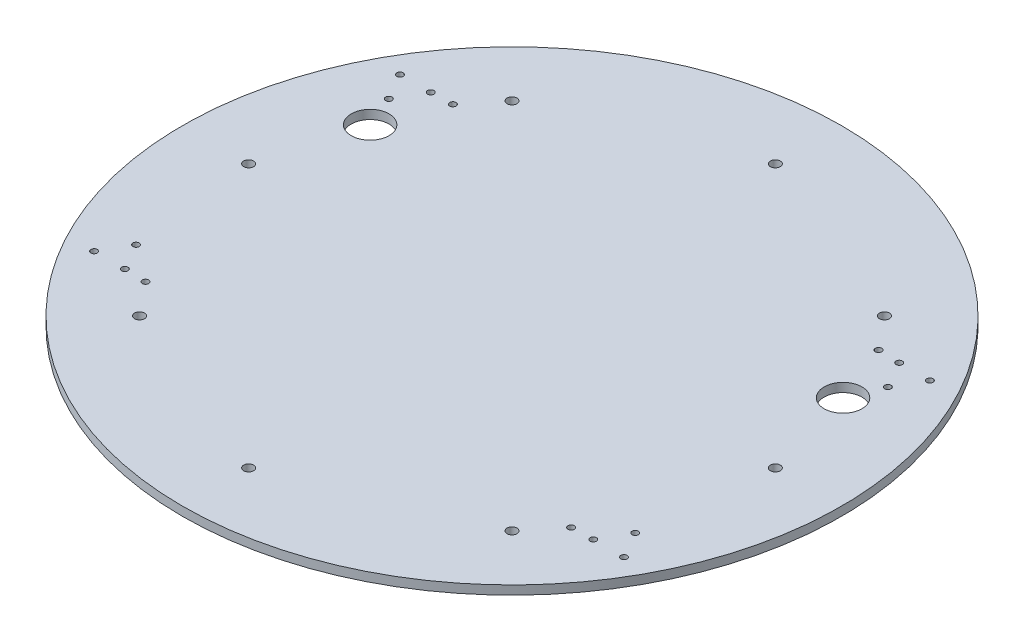
from build123d import *

# Parameters (mm, degrees)
SKETCH1_R           = 177
BOSS_EXTRUDE1_DEPTH = 4.7625
SKETCH3_R           = 1.7
CUT_EXTRUDE1_DEPTH  = 2.54
SKETCH4_R           = 1.7
CUT_EXTRUDE2_DEPTH  = 251.361102023
SKETCH5_R           = 10.16
WIRES_2_DEPTH       = 251.361102023
SKETCH6_R           = 2.667
ZIP_TIES_DEPTH      = 251.361102023


with BuildPart() as part:
    # Sketch1 → Boss-Extrude1 (new body)
    with BuildSketch(Plane(origin=(0, 0, 0), x_dir=(1, 0, 0), z_dir=(0, 1, 0))):
        with Locations(Location((0, 0, 0), (0, 0, 90))):
            Circle(SKETCH1_R)
    extrude(amount=BOSS_EXTRUDE1_DEPTH)

    # Sketch3 → Cut-Extrude1 (cut)
    with BuildSketch(Plane(origin=(0, 4.7625, 0), x_dir=(1, 0, 0), z_dir=(0, 1, 0))):
        with Locations(Location((-114.3, -82.55, 0), (0, 0, 270))):
            Circle(SKETCH3_R)
        with Locations(Location((-114.3, 82.55, 0), (0, 0, 270))):
            Circle(SKETCH3_R)
        with Locations(Location((114.3, 82.55, 0), (0, 0, 270))):
            Circle(SKETCH3_R)
        with Locations(Location((114.3, -82.55, 0), (0, 0, 270))):
            Circle(SKETCH3_R)
    extrude(amount=-CUT_EXTRUDE1_DEPTH, mode=Mode.SUBTRACT)

    # Sketch4 → Cut-Extrude2 (cut, through all)
    with BuildSketch(Plane(origin=(0, 4.7625, 0), x_dir=(1, 0, 0), z_dir=(0, 1, 0))):
        with Locations(Location((142.287973842, -82.15, 0), (0, 0, 270))):
            Circle(SKETCH4_R)
        with Locations(Location((125.7901899, -82.15, 0), (0, 0, 270))):
            Circle(SKETCH4_R)
        with Locations(Location((134.039081871, -67.8625, 0), (0, 0, 270))):
            Circle(SKETCH4_R)
        with Locations(Location((-134.039081871, -67.8625, 0), (0, 0, 270))):
            Circle(SKETCH4_R)
        with Locations(Location((-125.7901899, -82.15, 0), (0, 0, 270))):
            Circle(SKETCH4_R)
        with Locations(Location((-142.287973842, -82.15, 0), (0, 0, 270))):
            Circle(SKETCH4_R)
        with Locations(Location((-142.287973842, 82.15, 0), (0, 0, 270))):
            Circle(SKETCH4_R)
        with Locations(Location((-125.7901899, 82.15, 0), (0, 0, 270))):
            Circle(SKETCH4_R)
        with Locations(Location((-134.039081871, 67.8625, 0), (0, 0, 270))):
            Circle(SKETCH4_R)
        with Locations(Location((134.039081871, 67.8625, 0), (0, 0, 270))):
            Circle(SKETCH4_R)
        with Locations(Location((125.7901899, 82.15, 0), (0, 0, 270))):
            Circle(SKETCH4_R)
        with Locations(Location((142.287973842, 82.15, 0), (0, 0, 270))):
            Circle(SKETCH4_R)
    extrude(amount=-CUT_EXTRUDE2_DEPTH, mode=Mode.SUBTRACT)

    # Sketch5 → Wires 2 (cut, through all)
    with BuildSketch(Plane(origin=(0, 4.7625, 0), x_dir=(1, 0, 0), z_dir=(0, 1, 0))):
        with Locations(Location((-127, 50.8, 0), (0, 0, 270))):
            Circle(SKETCH5_R)
        with Locations(Location((127, 50.8, 0), (0, 0, 270))):
            Circle(SKETCH5_R)
    extrude(amount=-WIRES_2_DEPTH, mode=Mode.SUBTRACT)

    # Sketch6 → Zip Ties (cut, through all)
    with BuildSketch(Plane(origin=(0, 4.7625, 0), x_dir=(1, 0, 0), z_dir=(0, 1, 0))):
        with Locations(Location((0, -141.44, 0), (0, 0, 270))):
            Circle(SKETCH6_R)
        with Locations(Location((-100.013183131, -100.013183131, 0), (0, 0, 270))):
            Circle(SKETCH6_R)
        with Locations(Location((-141.44, 0, 0), (0, 0, 270))):
            Circle(SKETCH6_R)
        with Locations(Location((-100.013183131, 100.013183131, 0), (0, 0, 270))):
            Circle(SKETCH6_R)
        with Locations(Location((0, 141.44, 0), (0, 0, 270))):
            Circle(SKETCH6_R)
        with Locations(Location((100.013183131, 100.013183131, 0), (0, 0, 270))):
            Circle(SKETCH6_R)
        with Locations(Location((141.44, 0, 0), (0, 0, 270))):
            Circle(SKETCH6_R)
        with Locations(Location((100.013183131, -100.013183131, 0), (0, 0, 270))):
            Circle(SKETCH6_R)
    extrude(amount=-ZIP_TIES_DEPTH, mode=Mode.SUBTRACT)


solid = part.part
